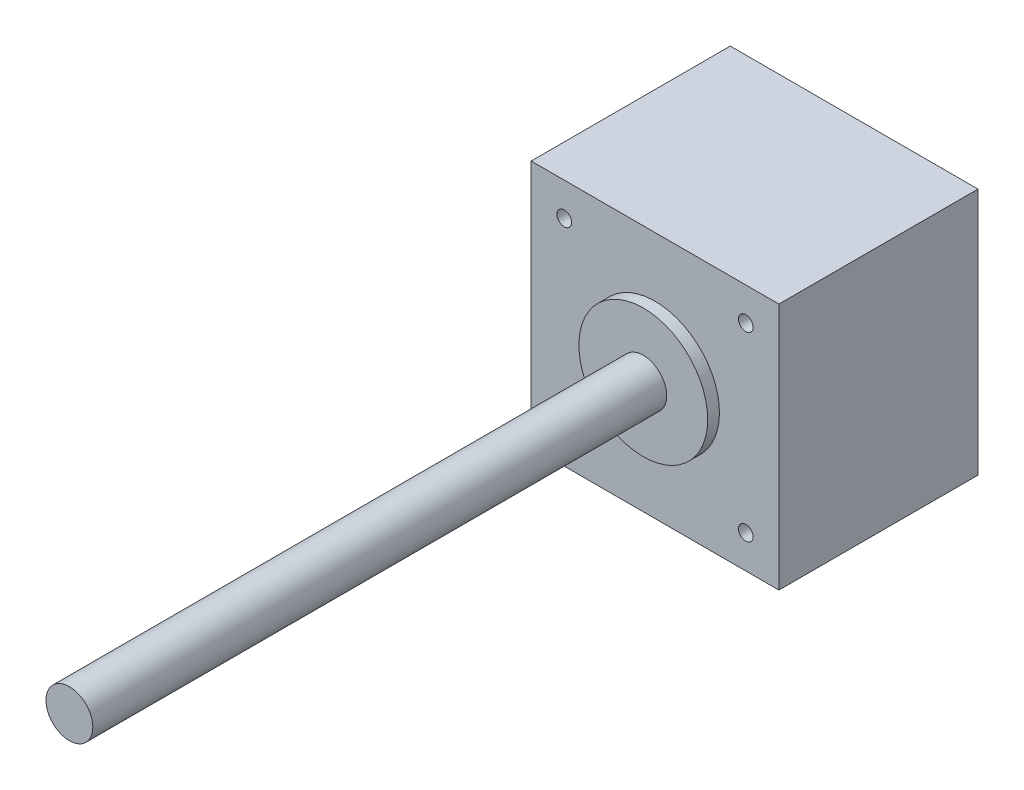
from build123d import *

# Parameters (mm, degrees)
SKETCH_1_W         = 42.3
SKETCH_1_H         = 42.3
EXTRUDE_1_DEPTH    = 34
SKETCH_2_R         = 11
EXTRUDE_2_DEPTH    = 2
SKETCH_3_R         = 4
EXTRUDE_3_DEPTH    = 98
HOLE_WIZARD_M3_1_D = 2.5


with BuildPart() as part:
    # 草图1 → 凸台-拉伸1 (new body)
    with BuildSketch(Plane.XY):
        Rectangle(SKETCH_1_W, SKETCH_1_H)
    extrude(amount=EXTRUDE_1_DEPTH)

    # 草图2 → 凸台-拉伸2 (add)
    with BuildSketch(Plane.XY.offset(34)):
        Circle(SKETCH_2_R)
    extrude(amount=EXTRUDE_2_DEPTH)

    # 草图3 → 凸台-拉伸3 (add)
    with BuildSketch(Plane.XY.offset(36)):
        Circle(SKETCH_3_R)
    extrude(amount=EXTRUDE_3_DEPTH)

    # M3 螺纹孔1 (through all)
    with Locations(Plane.XY.offset(34)):
        with Locations((-15.5, 15.5), (15.5, 15.5), (15.5, -15.5), (-15.5, -15.5)):
            Hole(HOLE_WIZARD_M3_1_D / 2)


solid = part.part
